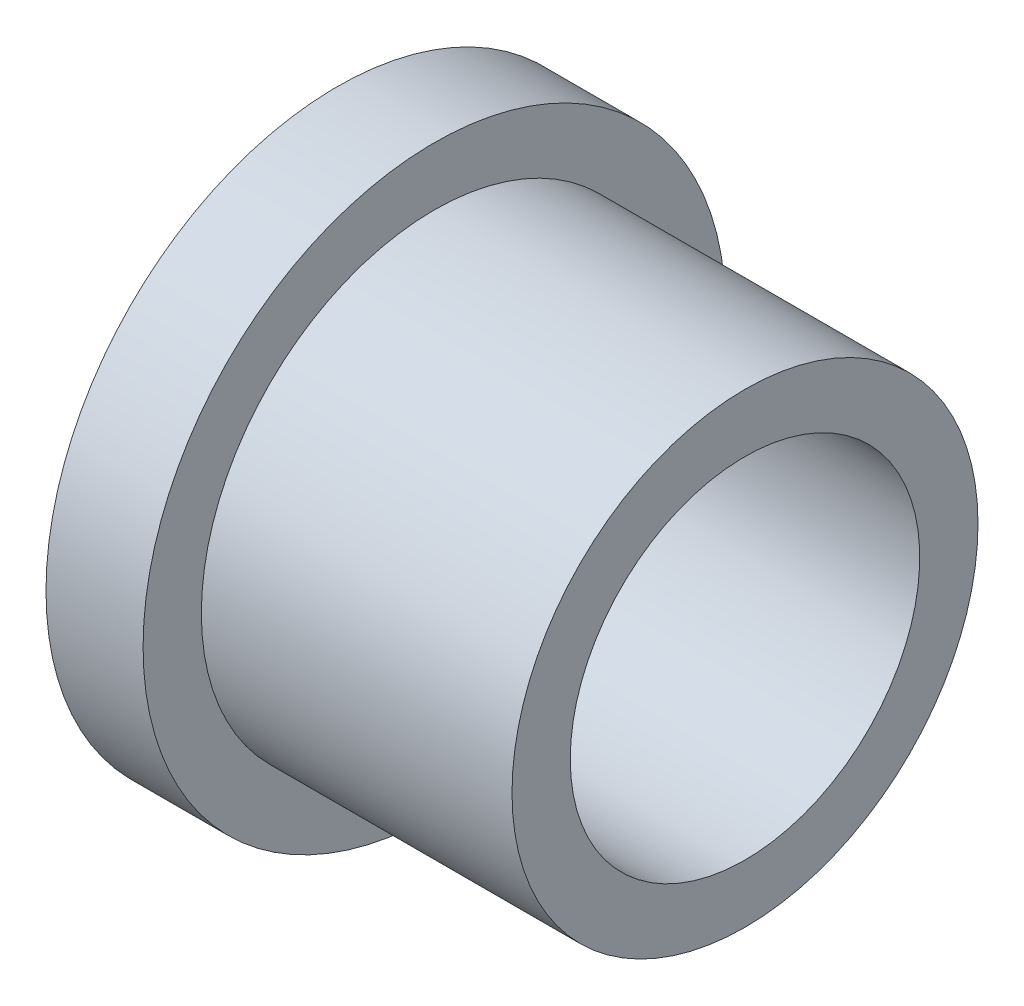
from build123d import *


with BuildPart() as part:
    # Sketch1 → Revolve1 (revolve)
    with BuildSketch(Plane.XY, mode=Mode.PRIVATE) as revolve1_sk:
        Polygon((0, 9), (21, 9), (21, 12), (5, 12), (5, 15), (0, 15), align=None)
    revolve(revolve1_sk.sketch.rotate(Axis((0, 0, 0), (1, 0, 0)), 90), axis=Axis((0, 0, 0), (1, 0, 0)))


solid = part.part
